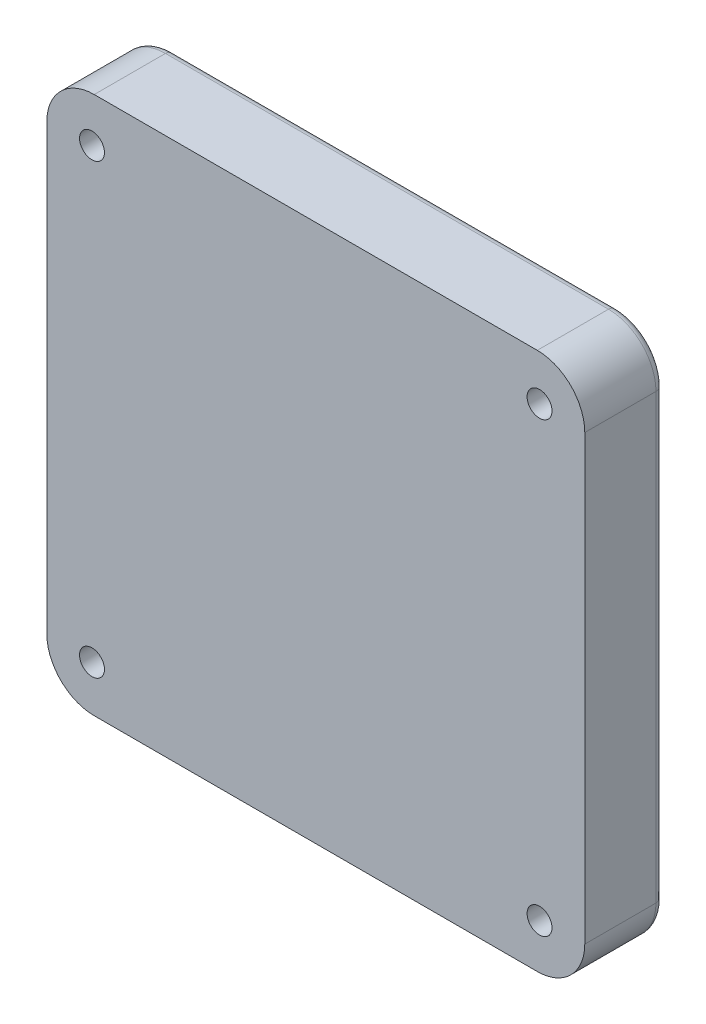
from build123d import *

# Parameters (mm, degrees)
SKETCH1_R           = 1.575
BOSS_EXTRUDE1_DEPTH = 10
FILLET1_R           = 1


with BuildPart() as part:
    # Sketch1 → Boss-Extrude1 (new body)
    with BuildSketch(Plane(origin=(0, 0, -96.995840519), x_dir=(-1, 0, 0), z_dir=(0, 0, -1))):
        with BuildLine():
            Line((-61.072792821, 13.25870832), (-117.072792821, 13.25870832))
            ThreePointArc((-117.072792821, 13.25870832), (-121.315433508, 15.016067633), (-123.072792821, 19.25870832))
            Line((-123.072792821, 19.25870832), (-123.072792821, 75.25870832))
            ThreePointArc((-123.072792821, 75.25870832), (-121.315433508, 79.501349008), (-117.072792821, 81.25870832))
            Line((-117.072792821, 81.25870832), (-61.072792821, 81.25870832))
            ThreePointArc((-61.072792821, 81.25870832), (-56.830152134, 79.501349008), (-55.072792821, 75.25870832))
            Line((-55.072792821, 75.25870832), (-55.072792821, 19.25870832))
            ThreePointArc((-55.072792821, 19.25870832), (-56.830152134, 15.016067633), (-61.072792821, 13.25870832))
        make_face()
        with Locations((-117.357064069, 75.542979568)):
            Circle(SKETCH1_R, mode=Mode.SUBTRACT)
        with Locations((-60.788521574, 75.542979568)):
            Circle(SKETCH1_R, mode=Mode.SUBTRACT)
        with Locations((-60.788521574, 18.974437073)):
            Circle(SKETCH1_R, mode=Mode.SUBTRACT)
        with Locations((-117.357064069, 18.974437073)):
            Circle(SKETCH1_R, mode=Mode.SUBTRACT)
    extrude(amount=BOSS_EXTRUDE1_DEPTH)

    # Fillet1
    fillet1_edges = [part.edges().sort_by_distance(p)[0] for p in [
        (56.830152134, 15.016067633, -106.995840519),
        (55.072792821, 47.25870832, -106.995840519),
        (56.830152134, 79.501349008, -106.995840519),
        (89.072792821, 81.25870832, -106.995840519),
        (121.315433508, 79.501349008, -106.995840519),
        (123.072792821, 47.25870832, -106.995840519),
        (121.315433508, 15.016067633, -106.995840519),
        (89.072792821, 13.25870832, -106.995840519),
    ]]
    fillet(fillet1_edges, radius=FILLET1_R)


solid = part.part
